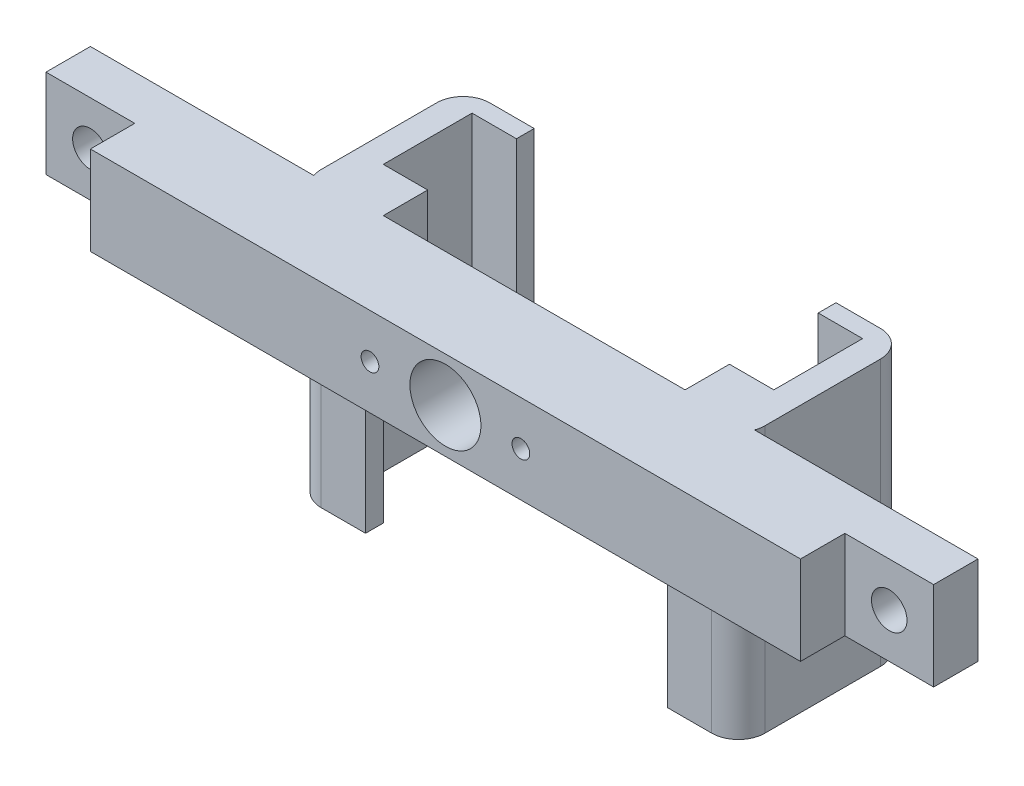
from build123d import *

# Parameters (mm, degrees)
SKETCH1_W           = 100
SKETCH1_H           = 10
BOSS_EXTRUDE1_DEPTH = 10
SKETCH6_W           = 3
SKETCH6_H           = 10
BOSS_EXTRUDE2_DEPTH = 17
SKETCH8_W           = 2
SKETCH8_H           = 10
BOSS_EXTRUDE3_DEPTH = 5
BOSS_EXTRUDE4_DEPTH = 20
SKETCH2_W           = 10
SKETCH2_H           = 5
CUT_EXTRUDE1_DEPTH  = 10
CUT_EXTRUDE2_REACH  = 62.075
SKETCH10_R          = 2
SKETCH13_R          = 4
SKETCH13_R_2        = 1
CUT_EXTRUDE3_DEPTH  = 59.429444632
FILLET1_R           = 3
FILLET2_R           = 3
SKETCH14_W          = 5
SKETCH14_H          = 10
BOSS_EXTRUDE5_DEPTH = 5


with BuildPart() as part:
    # Sketch1 → Boss-Extrude1 (new body)
    with BuildSketch(Plane.XY):
        Rectangle(SKETCH1_W, SKETCH1_H)
    extrude(amount=BOSS_EXTRUDE1_DEPTH)

    # Sketch6 → Boss-Extrude2 (add)
    with BuildSketch(Plane(origin=(0, 0, 0), x_dir=(-1, 0, 0), z_dir=(0, 0, -1))):
        with Locations((-23.5, 0)):
            Rectangle(SKETCH6_W, SKETCH6_H)
    boss_extrude2 = extrude(amount=BOSS_EXTRUDE2_DEPTH)

    # Sketch8 → Boss-Extrude3 (add)
    with BuildSketch(Plane.ZY.offset(-22)):
        with Locations((-16, 0)):
            Rectangle(SKETCH8_W, SKETCH8_H)
    boss_extrude3 = extrude(amount=BOSS_EXTRUDE3_DEPTH)

    # Sketch9 → Boss-Extrude4 (add)
    with BuildSketch(Plane.XZ.offset(5)):
        Polygon((17, 2), (17, 0), (22, 0), (22, -15), (17, -15), (17, -17), (25, -17), (25, 0), (25, 2), align=None)
    boss_extrude4 = extrude(amount=BOSS_EXTRUDE4_DEPTH)

    # Mirror3: Boss-Extrude2, Boss-Extrude3, Boss-Extrude4 across plane
    add(boss_extrude2.mirror(Plane(origin=(0, 0, 0), x_dir=(0, 0, 1), z_dir=(1, 0, 0))))
    add(boss_extrude3.mirror(Plane(origin=(0, 0, 0), x_dir=(0, 0, 1), z_dir=(1, 0, 0))))
    add(boss_extrude4.mirror(Plane(origin=(0, 0, 0), x_dir=(0, 0, 1), z_dir=(1, 0, 0))))

    # Sketch2 → Cut-Extrude1 (cut)
    with BuildSketch(Plane(origin=(0, 5, 0), x_dir=(1, 0, 0), z_dir=(0, 1, 0))):
        with Locations((-45, -7.5)):
            Rectangle(SKETCH2_W, SKETCH2_H)
    cut_extrude1 = extrude(amount=-CUT_EXTRUDE1_DEPTH, mode=Mode.SUBTRACT)

    # Mirror4: Cut-Extrude1 across plane
    add(cut_extrude1.mirror(Plane(origin=(0, 0, 0), x_dir=(0, 0, 1), z_dir=(1, 0, 0))), mode=Mode.SUBTRACT)

    # Sketch10 → Cut-Extrude2 (cut, up to next)
    with BuildSketch(Plane.XY.offset(5), mode=Mode.PRIVATE) as cut_extrude2_sk1:
        with Locations((45, 0)):
            Circle(SKETCH10_R)
    cut_extrude2_tool1 = extrude(cut_extrude2_sk1.sketch, amount=-CUT_EXTRUDE2_REACH, mode=Mode.PRIVATE) & part.part
    cut_extrude2 = cut_extrude2_tool1.solids().sort_by_distance((45, 0, 5))[0]
    add(cut_extrude2, mode=Mode.SUBTRACT)

    # Mirror5: Cut-Extrude2 across plane
    add(cut_extrude2.mirror(Plane(origin=(0, 0, 0), x_dir=(0, 0, 1), z_dir=(1, 0, 0))), mode=Mode.SUBTRACT)

    # Sketch13 → Cut-Extrude3 (cut, through all)
    with BuildSketch(Plane(origin=(0, 0, 0), x_dir=(-1, 0, 0), z_dir=(0, 0, -1))):
        Circle(SKETCH13_R)
        with Locations((-8.5, 0)):
            Circle(SKETCH13_R_2)
        with Locations((8.5, 0)):
            Circle(SKETCH13_R_2)
    extrude(amount=-CUT_EXTRUDE3_DEPTH, mode=Mode.SUBTRACT)

    # Fillet1
    fillet1_edges = [part.edges().sort_by_distance(p)[0] for p in [
        (25, -10, -17),
        (-25, -10, -17),
    ]]
    fillet(fillet1_edges, radius=FILLET1_R)

    # Fillet2
    fillet2_edges = [part.edges().sort_by_distance(p)[0] for p in [
        (-25, -15, 2),
        (25, -15, 2),
    ]]
    fillet(fillet2_edges, radius=FILLET2_R)

    # Sketch14 → Boss-Extrude5 (add)
    with BuildSketch(Plane(origin=(0, 0, 0), x_dir=(-1, 0, 0), z_dir=(0, 0, -1))):
        with Locations((19.5, 0)):
            Rectangle(SKETCH14_W, SKETCH14_H)
    boss_extrude5 = extrude(amount=BOSS_EXTRUDE5_DEPTH)

    # Mirror6: Boss-Extrude5 across plane
    add(boss_extrude5.mirror(Plane(origin=(0, 0, 0), x_dir=(0, 0, 1), z_dir=(1, 0, 0))))


solid = part.part
